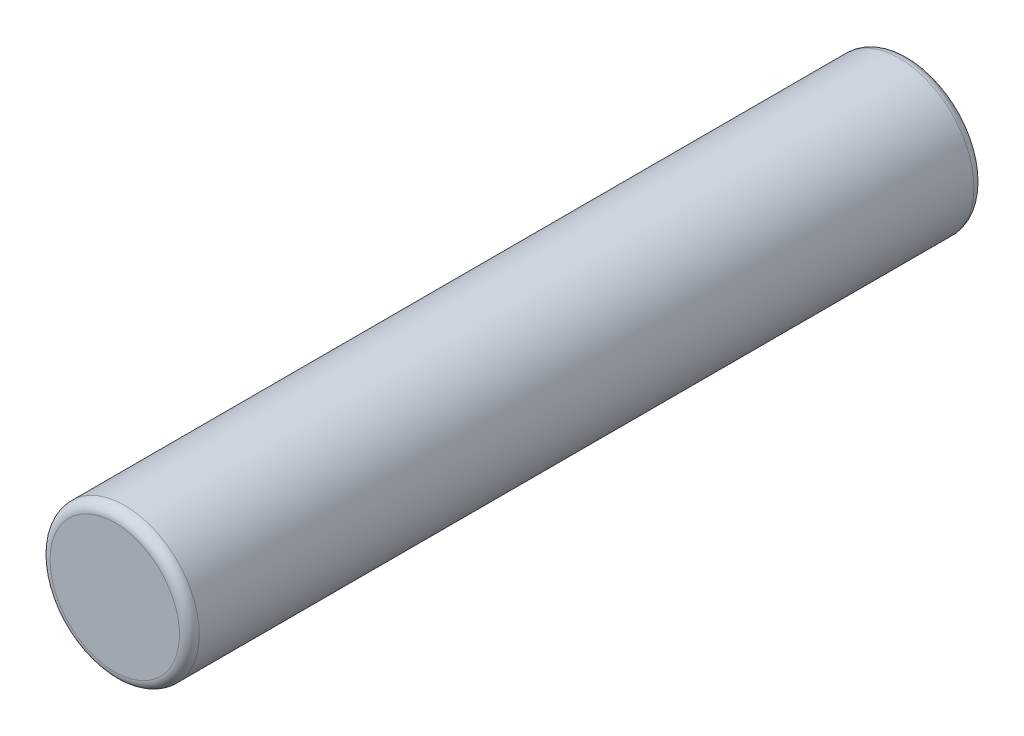
from build123d import *

# Parameters (mm, degrees)
ESQUISSE1_W = 16
ESQUISSE1_H = 1.5025
CONG_1_R    = 0.2
CONG_2_R    = 0.2


with BuildPart() as part:
    # Esquisse1 → Révolution1 (revolve)
    with BuildSketch(Plane(origin=(0, 0, 0), x_dir=(0, 0, -1), z_dir=(1, 0, 0)), mode=Mode.PRIVATE) as r_volution1_sk:
        with Locations((8, 0.75125)):
            Rectangle(ESQUISSE1_W, ESQUISSE1_H)
    revolve(r_volution1_sk.sketch.rotate(Axis((0, 0, 0), (0, 0, -1)), 90), axis=Axis((0, 0, 0), (0, 0, -1)))

    # Congé1
    cong_1_edges = [part.edges().sort_by_distance(p)[0] for p in [
        (-1.5025, 0, -16),
    ]]
    fillet(cong_1_edges, radius=CONG_1_R)

    # Congé2
    cong_2_edges = [part.edges().sort_by_distance(p)[0] for p in [
        (-1.5025, 0, 0),
    ]]
    fillet(cong_2_edges, radius=CONG_2_R)


solid = part.part
